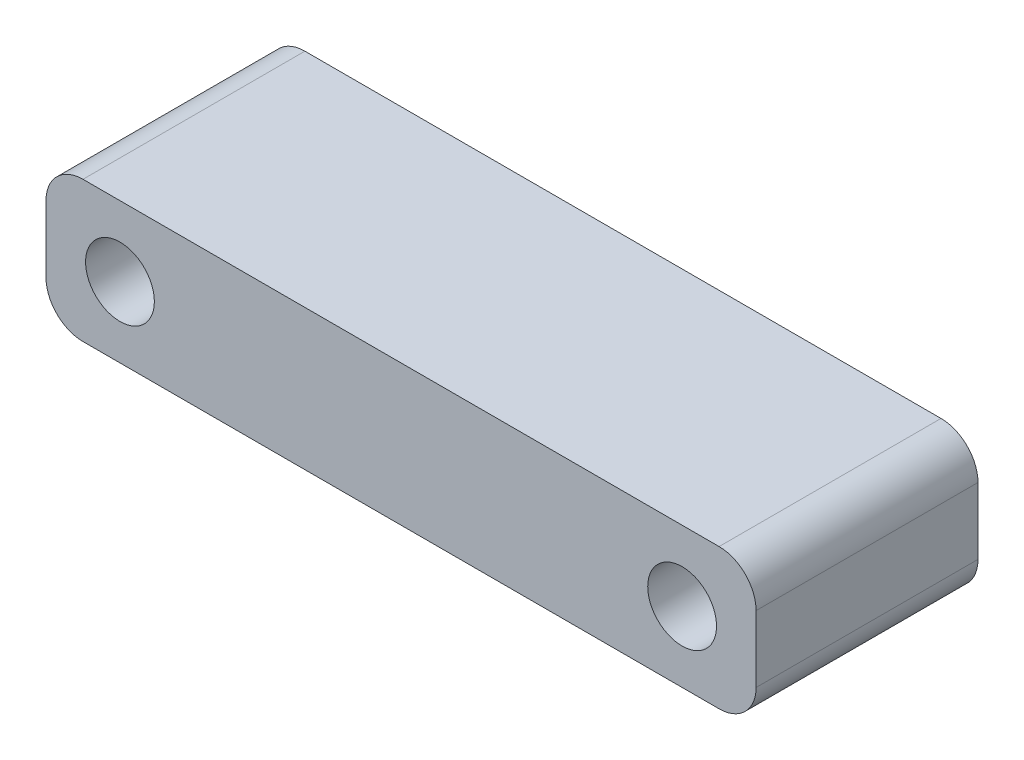
from build123d import *

# Parameters (mm, degrees)
SKETCH_1_W      = 96
SKETCH_1_H      = 19
SKETCH_1_R      = 4.65
EXTRUDE_1_DEPTH = 30
FILLET_1_R      = 5


with BuildPart() as part:
    # 草图1 → 凸台-拉伸1 (new body)
    with BuildSketch(Plane.XY):
        Rectangle(SKETCH_1_W, SKETCH_1_H)
        with Locations((-38, 0)):
            Circle(SKETCH_1_R, mode=Mode.SUBTRACT)
        with Locations(Location((38, 0, 0), (0, 0, 180))):
            Circle(SKETCH_1_R, mode=Mode.SUBTRACT)
    extrude(amount=EXTRUDE_1_DEPTH)

    # 圆角1
    fillet_1_edges = [part.edges().sort_by_distance(p)[0] for p in [
        (48, -9.5, 15),
        (-48, -9.5, 15),
        (-48, 9.5, 15),
        (48, 9.5, 15),
    ]]
    fillet(fillet_1_edges, radius=FILLET_1_R)


solid = part.part
